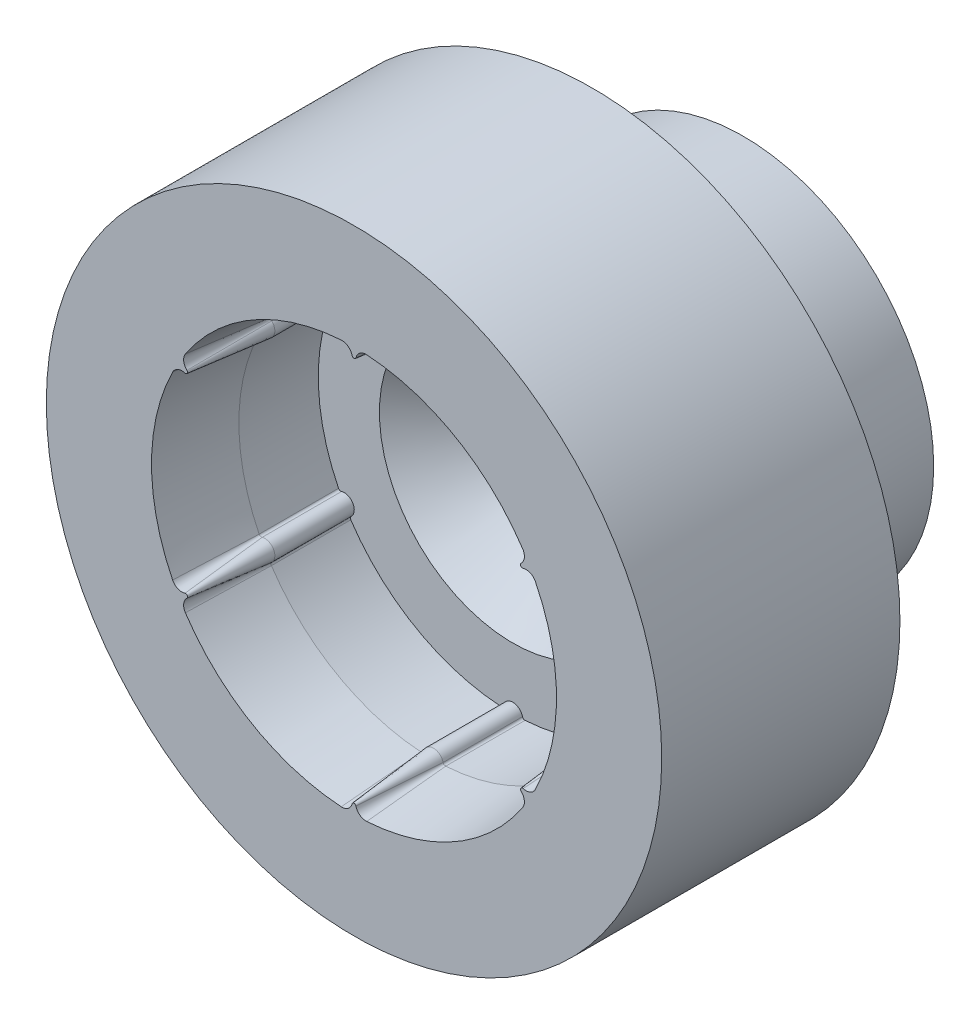
from build123d import *

# Parameters (mm, degrees)
SKETCH1_R                  = 4.9
BOSS_EXTRUDE1_DEPTH        = 2
SKETCH1_3_R                = 7.75
SKETCH1_3_R_2              = 4.9
BOSS_EXTRUDE2_DEPTH        = 6
BOSS_EXTRUDE3_START        = -3.8
SKETCH1_4_R                = 4.9
BOSS_EXTRUDE3_DEPTH        = 3.8
CSK_FOR_SFHCS1_D           = 3.2
CSK_FOR_SFHCS1_CSINK_D     = 6.72
CSK_FOR_SFHCS1_CSINK_ANGLE = 90
BOSS_EXTRUDE4_DEPTH        = 6
CIRPATTERN1_COUNT          = 6
CHAMFER2_SIZE              = 0.2
CHAMFER2_SIZE2             = 2
CHAMFER3_SIZE              = 0.1
CHAMFER3_SIZE2             = 2.5


with BuildPart() as part:
    # Sketch1 → Boss-Extrude1 (new body)
    with BuildSketch(Plane.XY):
        Circle(SKETCH1_R)
    extrude(amount=BOSS_EXTRUDE1_DEPTH)

    # Sketch1<3> → Boss-Extrude2 (add)
    with BuildSketch(Plane.XY):
        Circle(SKETCH1_3_R)
        Circle(SKETCH1_3_R_2, mode=Mode.SUBTRACT)
    extrude(amount=BOSS_EXTRUDE2_DEPTH)

    # Sketch1<4> → Boss-Extrude3 (add)
    with BuildSketch(Plane.XY.offset(BOSS_EXTRUDE3_START)):
        Circle(SKETCH1_4_R)
    extrude(amount=BOSS_EXTRUDE3_DEPTH)

    # CSK for  SFHCS1 (through all)
    with Locations(Plane.XY.offset(2)):
        with Locations((0, 0)):
            CounterSinkHole(CSK_FOR_SFHCS1_D / 2, CSK_FOR_SFHCS1_CSINK_D / 2, counter_sink_angle=CSK_FOR_SFHCS1_CSINK_ANGLE)

    # Sketch1<5> → Boss-Extrude4 (add)
    with BuildSketch(Plane.XY):
        with BuildLine():
            ThreePointArc((0.243261431, 4.842346934), (0.266872757, 4.878154286), (0.308005444, 4.890310077))
            ThreePointArc((0.308005444, 4.890310077), (1.2e-08, 4.9), (-0.308005421, 4.890310078))
            ThreePointArc((-0.308005421, 4.890310078), (-0.266872748, 4.878154279), (-0.243261431, 4.842346934))
            ThreePointArc((-0.243261431, 4.842346934), (0, 4.65), (0.243261431, 4.842346934))
        make_face()
    boss_extrude4 = extrude(amount=BOSS_EXTRUDE4_DEPTH)

    # CirPattern1: Boss-Extrude4 ×6 about axis
    cirpattern1_axis = Axis((0, 0, 0), (0, 0, 1))
    for i in range(1, CIRPATTERN1_COUNT):
        add(boss_extrude4.rotate(cirpattern1_axis, i * 360 / CIRPATTERN1_COUNT))

    # Chamfer2
    chamfer2_edges = [part.edges().sort_by_distance(p)[0] for p in [
        (-4.091169155, -2.670195719, 6),
        (-4.358041914, -2.207958555, 6),
        (-4.027018128, -2.325, 6),
        (2.44999999, -4.243524484, 6),
        (0.266872748, -4.878154279, 6),
        (-0.266872757, -4.878154286, 6),
        (0, -4.65, 6),
        (4.9, -1.2e-08, 6),
        (4.358041903, -2.20795856, 6),
        (4.091169156, -2.67019573, 6),
        (4.027018128, -2.325, 6),
        (2.45000001, 4.243524473, 6),
        (4.091169155, 2.670195719, 6),
        (4.358041914, 2.207958555, 6),
        (4.027018128, 2.325, 6),
        (-2.44999999, 4.243524484, 6),
        (-0.266872748, 4.878154279, 6),
        (0.266872757, 4.878154286, 6),
        (0, 4.65, 6),
        (-4.9, 1.2e-08, 6),
        (-4.358041903, 2.20795856, 6),
        (-4.091169156, 2.67019573, 6),
        (-4.027018128, 2.325, 6),
        (-2.45000001, -4.243524473, 6),
    ]]
    chamfer2_side = [part.faces().sort_by_distance(p)[0] for p in [
        (-7.530796898, 0, 6),
    ]]
    chamfer(chamfer2_edges, length=CHAMFER2_SIZE, length2=CHAMFER2_SIZE2, reference=chamfer2_side[0])

    # Chamfer3
    chamfer3_edges = [part.edges().sort_by_distance(p)[0] for p in [
        (-4.9, 0, -3.8),
    ]]
    chamfer3_side = [part.faces().sort_by_distance(p)[0] for p in [
        (-4.761407071, 0, -3.8),
    ]]
    chamfer(chamfer3_edges, length=CHAMFER3_SIZE, length2=CHAMFER3_SIZE2, reference=chamfer3_side[0])


solid = part.part
